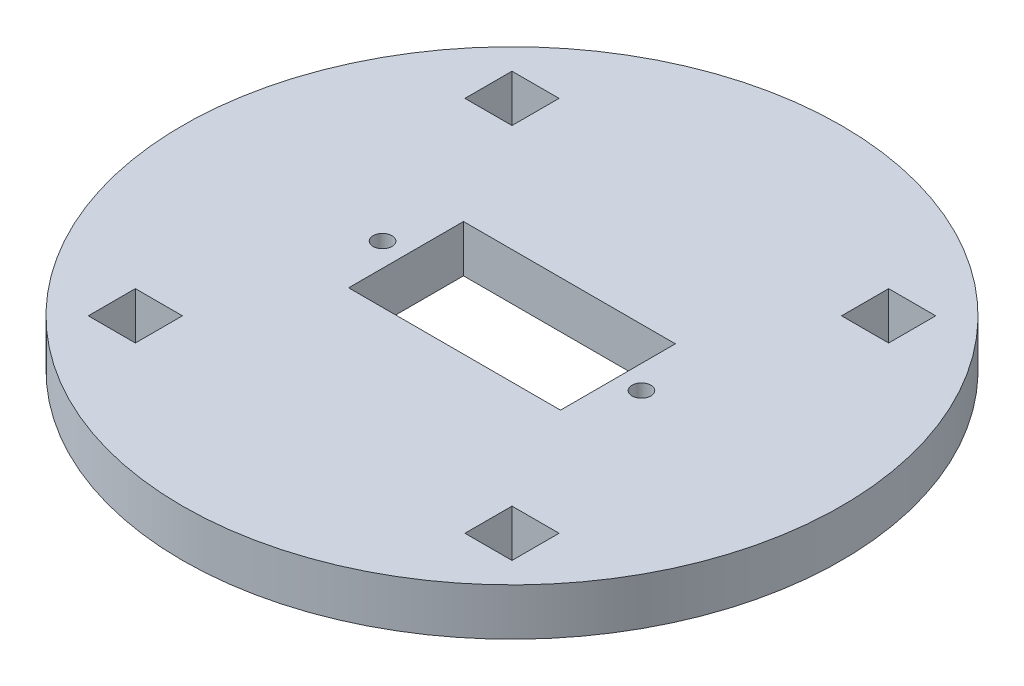
from build123d import *

# Parameters (mm, degrees)
SKETCH1_R           = 35
SKETCH1_R_2         = 1
SKETCH1_W           = 22.5
SKETCH1_H           = 12.2
SKETCH1_W_2         = 5
SKETCH1_H_2         = 5
BOSS_EXTRUDE1_DEPTH = 5


with BuildPart() as part:
    # Sketch1 → Boss-Extrude1 (new body)
    with BuildSketch(Plane(origin=(0, 0, 0), x_dir=(1, 0, 0), z_dir=(0, 1, 0))):
        with Locations(Location((0, 0, 0), (0, 0, 270))):
            Circle(SKETCH1_R)
        with Locations(Location((13.75, 0, 0), (0, 0, 270))):
            Circle(SKETCH1_R_2, mode=Mode.SUBTRACT)
        with Locations(Location((-13.75, 0, 0), (0, 0, 270))):
            Circle(SKETCH1_R_2, mode=Mode.SUBTRACT)
        Rectangle(SKETCH1_W, SKETCH1_H, mode=Mode.SUBTRACT)
        with Locations((-20, -20)):
            Rectangle(SKETCH1_W_2, SKETCH1_H_2, mode=Mode.SUBTRACT)
        with Locations((-20, 20)):
            Rectangle(SKETCH1_W_2, SKETCH1_H_2, mode=Mode.SUBTRACT)
        with Locations((20, 20)):
            Rectangle(SKETCH1_W_2, SKETCH1_H_2, mode=Mode.SUBTRACT)
        with Locations((20, -20)):
            Rectangle(SKETCH1_W_2, SKETCH1_H_2, mode=Mode.SUBTRACT)
    extrude(amount=BOSS_EXTRUDE1_DEPTH)


solid = part.part
